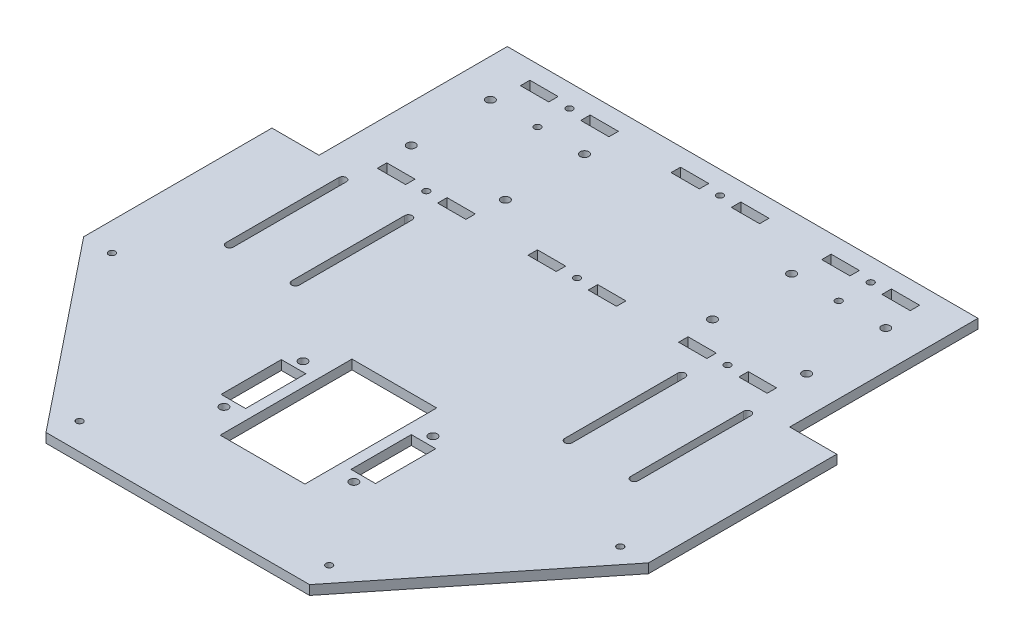
from build123d import *

# Parameters (mm, degrees)
SKETCH_2_R          = 2.25
EXTRUDE_2_DEPTH     = 5
SKETCH_3_W          = 25
SKETCH_3_H          = 100
CUT_EXTRUDE_1_DEPTH = 5
CUT_EXTRUDE_2_DEPTH = 5
SKETCH_5_R          = 1.75
SKETCH_5_W          = 15
SKETCH_5_H          = 5
CUT_EXTRUDE_3_DEPTH = 213.190951739
SKETCH_7_R          = 2.25
SKETCH_7_W          = 13
SKETCH_7_H          = 32
SKETCH_7_W_2        = 45
SKETCH_7_H_2        = 70
CUT_EXTRUDE_4_DEPTH = 10
SKETCH_8_R          = 1.75
CUT_EXTRUDE_5_DEPTH = 213.190951739


with BuildPart() as part:
    # 草圖2 → 填料-伸長2 (new body)
    with BuildSketch(Plane(origin=(0, 0, 0), x_dir=(1, 0, 0), z_dir=(0, 1, 0))):
        Polygon((-150, 150), (150, 150), (150, -50), (70, -150), (-70, -150), (-150, -50), align=None)
        with Locations(Location((-105, 121, 0), (0, 0, 270))):
            Circle(SKETCH_2_R, mode=Mode.SUBTRACT)
        with Locations(Location((-105, 79, 0), (0, 0, 270))):
            Circle(SKETCH_2_R, mode=Mode.SUBTRACT)
        with Locations(Location((-55, 79, 0), (0, 0, 270))):
            Circle(SKETCH_2_R, mode=Mode.SUBTRACT)
        with Locations(Location((-55, 121, 0), (0, 0, 270))):
            Circle(SKETCH_2_R, mode=Mode.SUBTRACT)
        with Locations(Location((55, 121, 0), (0, 0, 270))):
            Circle(SKETCH_2_R, mode=Mode.SUBTRACT)
        with Locations(Location((55, 79, 0), (0, 0, 270))):
            Circle(SKETCH_2_R, mode=Mode.SUBTRACT)
        with Locations(Location((105, 121, 0), (0, 0, 270))):
            Circle(SKETCH_2_R, mode=Mode.SUBTRACT)
        with Locations(Location((105, 79, 0), (0, 0, 270))):
            Circle(SKETCH_2_R, mode=Mode.SUBTRACT)
    extrude(amount=EXTRUDE_2_DEPTH)

    # 草圖3 → 除料-伸長1 (cut)
    with BuildSketch(Plane(origin=(0, 5, 0), x_dir=(1, 0, 0), z_dir=(0, 1, 0))):
        with Locations((-137.5, 100)):
            Rectangle(SKETCH_3_W, SKETCH_3_H)
        with Locations((137.5, 100)):
            Rectangle(SKETCH_3_W, SKETCH_3_H)
    extrude(amount=-CUT_EXTRUDE_1_DEPTH, mode=Mode.SUBTRACT)

    # 草圖4 → 除料-伸長2 (cut)
    with BuildSketch(Plane(origin=(0, 5, 0), x_dir=(1, 0, 0), z_dir=(0, 1, 0))):
        with BuildLine():
            Line((-105.5, 45), (-105.5, -15))
            ThreePointArc((-105.5, -15), (-107.5, -17), (-109.5, -15))
            Line((-109.5, -15), (-109.5, 45))
            ThreePointArc((-109.5, 45), (-107.5, 47), (-105.5, 45))
        make_face()
        with BuildLine():
            Line((-74.5, 45), (-74.5, -15))
            ThreePointArc((-74.5, -15), (-72.5, -17), (-70.5, -15))
            Line((-70.5, -15), (-70.5, 45))
            ThreePointArc((-70.5, 45), (-72.5, 47), (-74.5, 45))
        make_face()
        with BuildLine():
            Line((105.5, 45), (105.5, -15))
            ThreePointArc((105.5, -15), (107.5, -17), (109.5, -15))
            Line((109.5, -15), (109.5, 45))
            ThreePointArc((109.5, 45), (107.5, 47), (105.5, 45))
        make_face()
        with BuildLine():
            Line((74.5, 45), (74.5, -15))
            ThreePointArc((74.5, -15), (72.5, -17), (70.5, -15))
            Line((70.5, -15), (70.5, 45))
            ThreePointArc((70.5, 45), (72.5, 47), (74.5, 45))
        make_face()
    extrude(amount=-CUT_EXTRUDE_2_DEPTH, mode=Mode.SUBTRACT)

    # 草圖5 → 除料-伸長3 (cut, through all)
    with BuildSketch(Plane(origin=(0, 5, 0), x_dir=(1, 0, 0), z_dir=(0, 1, 0))):
        with Locations(Location((0, 62, 0), (0, 0, 270))):
            Circle(SKETCH_5_R)
        with Locations(Location((-80, 62, 0), (0, 0, 270))):
            Circle(SKETCH_5_R)
        with Locations(Location((80, 62, 0), (0, 0, 90))):
            Circle(SKETCH_5_R)
        with Locations(Location((80, 138, 0), (0, 0, 270))):
            Circle(SKETCH_5_R)
        with Locations(Location((-80, 138, 0), (0, 0, 90))):
            Circle(SKETCH_5_R)
        with Locations(Location((0, 138, 0), (0, 0, 90))):
            Circle(SKETCH_5_R)
        with Locations((16, 62)):
            Rectangle(SKETCH_5_W, SKETCH_5_H)
        with Locations((-16, 62)):
            Rectangle(SKETCH_5_W, SKETCH_5_H)
        with Locations((-96, 62)):
            Rectangle(SKETCH_5_W, SKETCH_5_H)
        with Locations((-64, 62)):
            Rectangle(SKETCH_5_W, SKETCH_5_H)
        with Locations((64, 62)):
            Rectangle(SKETCH_5_W, SKETCH_5_H)
        with Locations((96, 62)):
            Rectangle(SKETCH_5_W, SKETCH_5_H)
        with Locations((96, 138)):
            Rectangle(SKETCH_5_W, SKETCH_5_H)
        with Locations((64, 138)):
            Rectangle(SKETCH_5_W, SKETCH_5_H)
        with Locations((-64, 138)):
            Rectangle(SKETCH_5_W, SKETCH_5_H)
        with Locations((-96, 138)):
            Rectangle(SKETCH_5_W, SKETCH_5_H)
        with Locations((16, 138)):
            Rectangle(SKETCH_5_W, SKETCH_5_H)
        with Locations((-16, 138)):
            Rectangle(SKETCH_5_W, SKETCH_5_H)
    extrude(amount=-CUT_EXTRUDE_3_DEPTH, mode=Mode.SUBTRACT)

    # 草圖7 → 除料-伸長4 (cut)
    with BuildSketch(Plane(origin=(0, 5, 0), x_dir=(1, 0, 0), z_dir=(0, 1, 0))):
        with Locations(Location((-34.5, -49, 0), (0, 0, 270))):
            Circle(SKETCH_7_R)
        with Locations(Location((-34.5, -91, 0), (0, 0, 270))):
            Circle(SKETCH_7_R)
        with Locations(Location((34.5, -91, 0), (0, 0, 270))):
            Circle(SKETCH_7_R)
        with Locations(Location((34.5, -49, 0), (0, 0, 270))):
            Circle(SKETCH_7_R)
        with Locations((34.5, -70)):
            Rectangle(SKETCH_7_W, SKETCH_7_H)
        with Locations((0, -70)):
            Rectangle(SKETCH_7_W_2, SKETCH_7_H_2)
        with Locations((-34.5, -70)):
            Rectangle(SKETCH_7_W, SKETCH_7_H)
    extrude(amount=-CUT_EXTRUDE_4_DEPTH, mode=Mode.SUBTRACT)

    # 草圖8 → 除料-伸長5 (cut, through all)
    with BuildSketch(Plane(origin=(0, 5, 0), x_dir=(1, 0, 0), z_dir=(0, 1, 0))):
        with Locations(Location((-80, 121, 0), (0, 0, 270))):
            Circle(SKETCH_8_R)
        with Locations(Location((80, 121, 0), (0, 0, 90))):
            Circle(SKETCH_8_R)
        with Locations(Location((-135, -50, 0), (0, 0, 270))):
            Circle(SKETCH_8_R)
        with Locations(Location((-66.283544769, -135.895569039, 0), (0, 0, 270))):
            Circle(SKETCH_8_R)
        with Locations(Location((135, -50, 0), (0, 0, 90))):
            Circle(SKETCH_8_R)
        with Locations(Location((66.283544769, -135.895569039, 0), (0, 0, 90))):
            Circle(SKETCH_8_R)
    extrude(amount=-CUT_EXTRUDE_5_DEPTH, mode=Mode.SUBTRACT)


solid = part.part
